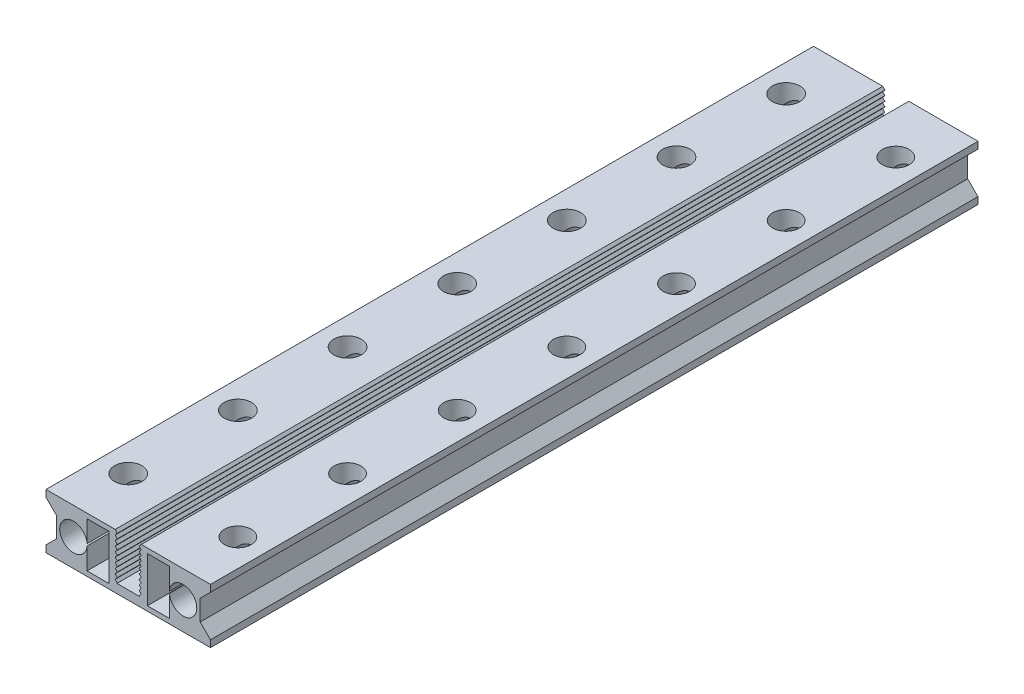
from build123d import *

# Parameters (mm, degrees)
EXTRUDE_2_DEPTH        = 112
EXTRUDE_3_DEPTH        = 112
PATTERN_LINEAR_1_COUNT = 10
PATTERN_LINEAR_1_PITCH = 0.7
MIRROR_1_COPY_1_DEPTH  = 112
MIRROR_1_COPY_2_DEPTH  = 112
MIRROR_1_COPY_3_DEPTH  = 112
MIRROR_1_COPY_4_DEPTH  = 112
MIRROR_1_COPY_5_DEPTH  = 112
MIRROR_1_COPY_6_DEPTH  = 112
MIRROR_1_COPY_7_DEPTH  = 112
MIRROR_1_COPY_8_DEPTH  = 112
MIRROR_1_COPY_9_DEPTH  = 112
SKETCH_4_R             = 2
SKETCH_4_R_2           = 1.95
CUT_EXTRUDE_1_DEPTH    = 113.924753708
PATTERN_LINEAR_2_COUNT = 7
PATTERN_LINEAR_2_PITCH = 16


with BuildPart() as part:
    # 草图1 → 凸台-拉伸2 (new body)
    with BuildSketch(Plane.XY):
        Polygon((-1.9, 8), (-12, 8), (-12, 7), (-10.5, 5.5), (-10.5, 2.5), (-12, 1), (-12, 0), (12, 0), (12, 1), (10.5, 2.5), (10.5, 5.5), (12, 7), (12, 8), (1.9, 8), (1.9, 1.3), (-1.9, 1.3), align=None)
        with BuildLine():
            Line((-6.005, 4.14133294), (-6.005, 7.3))
            Line((-6.005, 7.3), (-2.8, 7.3))
            Line((-2.8, 7.3), (-2.8, 0.7))
            Line((-2.8, 0.7), (-6.005, 0.7))
            Line((-6.005, 0.7), (-6.005, 3.85866706))
            ThreePointArc((-6.005, 3.85866706), (-10, 4), (-6.005, 4.14133294))
        make_face(mode=Mode.SUBTRACT)
        with BuildLine():
            Line((2.8, 0.7), (2.8, 7.3))
            Line((2.8, 7.3), (6.005, 7.3))
            Line((6.005, 7.3), (6.005, 4.14133294))
            ThreePointArc((6.005, 4.14133294), (10, 4), (6.005, 3.85866706))
            Line((6.005, 3.85866706), (6.005, 0.7))
            Line((6.005, 0.7), (2.8, 0.7))
        make_face(mode=Mode.SUBTRACT)
    extrude(amount=EXTRUDE_2_DEPTH)

    # 草图3 → 凸台-拉伸3 (add)
    with BuildSketch(Plane.XY.offset(112)):
        Polygon((-1.9, 8), (-1.6, 7.65), (-1.9, 7.3), align=None)
    extrude_3 = extrude(amount=-EXTRUDE_3_DEPTH)

    # 阵列(线性)1: 凸台-拉伸3 ×10
    with Locations(*[(0, -i * PATTERN_LINEAR_1_PITCH, 0) for i in range(1, PATTERN_LINEAR_1_COUNT)]):
        add(extrude_3)

    # 镜向1: 凸台-拉伸3 across plane
    add(extrude_3.mirror(Plane(origin=(0, 0, 0), x_dir=(0, 0, 1), z_dir=(1, 0, 0))))

    # 镜向1 copy 1 sketch → 镜向1 copy 1 (add)
    with BuildSketch(Plane(origin=(0, -0.7, 112), x_dir=(-1, 0, 0), z_dir=(0, 0, 1))):
        Polygon((-1.9, -8), (-1.6, -7.65), (-1.9, -7.3), align=None)
    extrude(amount=-MIRROR_1_COPY_1_DEPTH)

    # 镜向1 copy 2 sketch → 镜向1 copy 2 (add)
    with BuildSketch(Plane(origin=(0, -1.4, 112), x_dir=(-1, 0, 0), z_dir=(0, 0, 1))):
        Polygon((-1.9, -8), (-1.6, -7.65), (-1.9, -7.3), align=None)
    extrude(amount=-MIRROR_1_COPY_2_DEPTH)

    # 镜向1 copy 3 sketch → 镜向1 copy 3 (add)
    with BuildSketch(Plane(origin=(0, -2.1, 112), x_dir=(-1, 0, 0), z_dir=(0, 0, 1))):
        Polygon((-1.9, -8), (-1.6, -7.65), (-1.9, -7.3), align=None)
    extrude(amount=-MIRROR_1_COPY_3_DEPTH)

    # 镜向1 copy 4 sketch → 镜向1 copy 4 (add)
    with BuildSketch(Plane(origin=(0, -2.8, 112), x_dir=(-1, 0, 0), z_dir=(0, 0, 1))):
        Polygon((-1.9, -8), (-1.6, -7.65), (-1.9, -7.3), align=None)
    extrude(amount=-MIRROR_1_COPY_4_DEPTH)

    # 镜向1 copy 5 sketch → 镜向1 copy 5 (add)
    with BuildSketch(Plane(origin=(0, -3.5, 112), x_dir=(-1, 0, 0), z_dir=(0, 0, 1))):
        Polygon((-1.9, -8), (-1.6, -7.65), (-1.9, -7.3), align=None)
    extrude(amount=-MIRROR_1_COPY_5_DEPTH)

    # 镜向1 copy 6 sketch → 镜向1 copy 6 (add)
    with BuildSketch(Plane(origin=(0, -4.2, 112), x_dir=(-1, 0, 0), z_dir=(0, 0, 1))):
        Polygon((-1.9, -8), (-1.6, -7.65), (-1.9, -7.3), align=None)
    extrude(amount=-MIRROR_1_COPY_6_DEPTH)

    # 镜向1 copy 7 sketch → 镜向1 copy 7 (add)
    with BuildSketch(Plane(origin=(0, -4.9, 112), x_dir=(-1, 0, 0), z_dir=(0, 0, 1))):
        Polygon((-1.9, -8), (-1.6, -7.65), (-1.9, -7.3), align=None)
    extrude(amount=-MIRROR_1_COPY_7_DEPTH)

    # 镜向1 copy 8 sketch → 镜向1 copy 8 (add)
    with BuildSketch(Plane(origin=(0, -5.6, 112), x_dir=(-1, 0, 0), z_dir=(0, 0, 1))):
        Polygon((-1.9, -8), (-1.6, -7.65), (-1.9, -7.3), align=None)
    extrude(amount=-MIRROR_1_COPY_8_DEPTH)

    # 镜向1 copy 9 sketch → 镜向1 copy 9 (add)
    with BuildSketch(Plane(origin=(0, -6.3, 112), x_dir=(-1, 0, 0), z_dir=(0, 0, 1))):
        Polygon((-1.9, -8), (-1.6, -7.65), (-1.9, -7.3), align=None)
    extrude(amount=-MIRROR_1_COPY_9_DEPTH)

    # 草图4 → 切除-拉伸1 (cut, through all)
    with BuildSketch(Plane(origin=(0, 8, 0), x_dir=(1, 0, 0), z_dir=(0, 1, 0))):
        with Locations(Location((-8, -8, 0), (0, 0, 180))):
            Circle(SKETCH_4_R)
        with Locations(Location((8, -8, 0), (0, 0, 180))):
            Circle(SKETCH_4_R_2)
    cut_extrude_1 = extrude(amount=-CUT_EXTRUDE_1_DEPTH, mode=Mode.SUBTRACT)

    # 阵列(线性)2: 切除-拉伸1 ×7
    with Locations(*[(0, 0, i * PATTERN_LINEAR_2_PITCH) for i in range(1, PATTERN_LINEAR_2_COUNT)]):
        add(cut_extrude_1, mode=Mode.SUBTRACT)


solid = part.part
